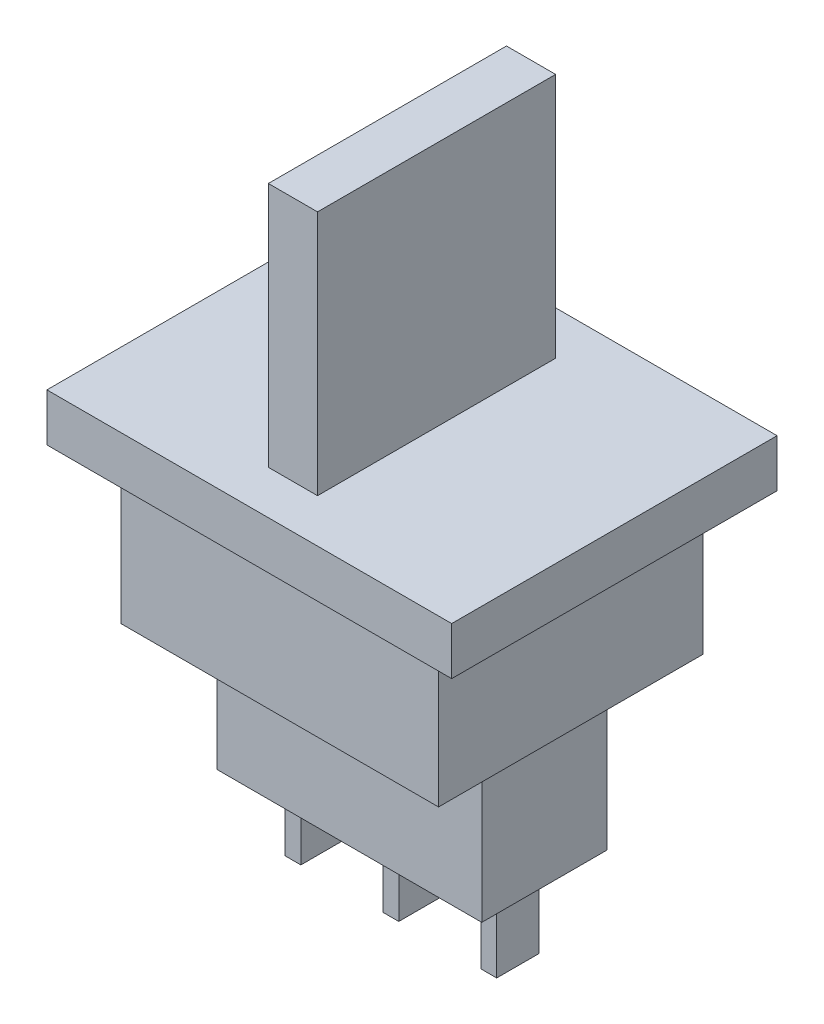
from build123d import *

# Parameters (mm, degrees)
SKETCH1_W                = 19.43
SKETCH1_H                = 15.62
BOSS_EXTRUDE1_DEPTH      = 2.29
SKETCH5_W                = 15.25
SKETCH5_H                = 12.7
BOSS_EXTRUDE2_DEPTH      = 7.11
SKETCH6_W                = 12.7
SKETCH6_H                = 6
BOSS_EXTRUDE3_DEPTH      = 7.11
SKETCH7_W                = 0.76
SKETCH7_H                = 2.03
BOSS_EXTRUDE4_DEPTH      = 3.94
BOSS_EXTRUDE5_DEPTH      = 5.715
BOSS_EXTRUDE5_DEPTH_BACK = 5.715
SKETCH8_W                = 2.36
SKETCH8_H                = 17.09


with BuildPart() as part:
    # Sketch1 → Boss-Extrude1 (new body)
    with BuildSketch(Plane(origin=(0, 0, 0), x_dir=(1, 0, 0), z_dir=(0, 1, 0))):
        Rectangle(SKETCH1_W, SKETCH1_H)
    extrude(amount=BOSS_EXTRUDE1_DEPTH)

    # Sketch5 → Boss-Extrude2 (add)
    with BuildSketch(Plane.XZ):
        Rectangle(SKETCH5_W, SKETCH5_H)
    extrude(amount=BOSS_EXTRUDE2_DEPTH)

    # Sketch6 → Boss-Extrude3 (add)
    with BuildSketch(Plane.XZ.offset(7.11)):
        Rectangle(SKETCH6_W, SKETCH6_H)
    extrude(amount=BOSS_EXTRUDE3_DEPTH)

    # Sketch7 → Boss-Extrude4 (add)
    with BuildSketch(Plane.XZ.offset(14.22)):
        Rectangle(SKETCH7_W, SKETCH7_H)
        with Locations((-4.7, 0)):
            Rectangle(SKETCH7_W, SKETCH7_H)
        with Locations((4.7, 0)):
            Rectangle(SKETCH7_W, SKETCH7_H)
    extrude(amount=BOSS_EXTRUDE4_DEPTH)

    # Sketch8 → Boss-Extrude5 (add, two sides: drawn at the far end of the back side and taken through both)
    with BuildSketch(Plane.XY.offset(-BOSS_EXTRUDE5_DEPTH_BACK)):
        with Locations((0, 5.545)):
            Rectangle(SKETCH8_W, SKETCH8_H)
    extrude(amount=BOSS_EXTRUDE5_DEPTH + BOSS_EXTRUDE5_DEPTH_BACK)


solid = part.part
